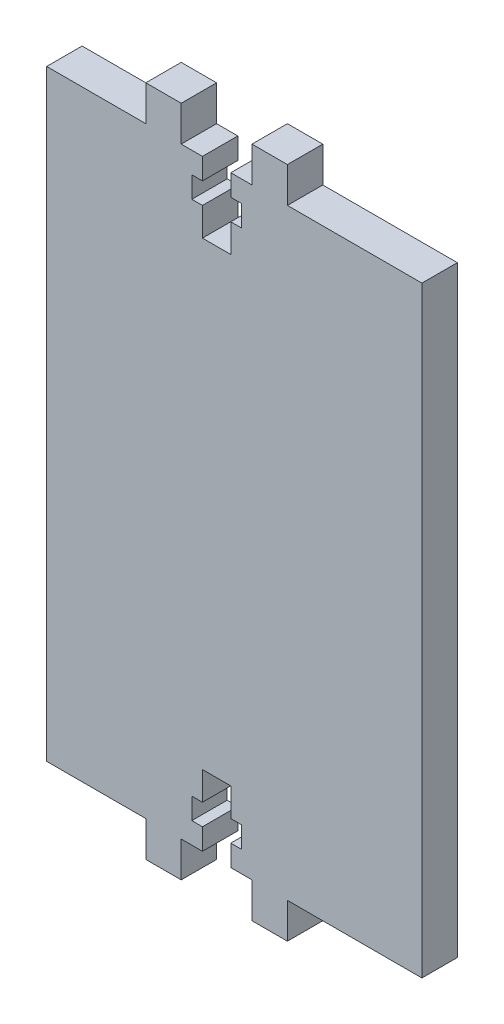
from build123d import *

# Parameters (mm, degrees)
BOSS_EXTRU_1_DEPTH = 5


with BuildPart() as part:
    # Esquisse2 → Boss.-Extru.1 (new body)
    with BuildSketch(Plane.XY):
        Polygon((-2, 82), (-3.5, 82), (-3.5, 79), (-2, 79), (-2, 75), (2, 75), (2, 79), (3.5, 79), (3.5, 82), (2, 82), (2, 85), (5, 85), (5, 90), (10, 90), (10, 85), (29, 85), (29, 0), (10, 0), (10, -5), (5, -5), (5, 0), (2, 0), (2, 3), (3.5, 3), (3.5, 6), (2, 6), (2, 10), (-2, 10), (-2, 6), (-3.5, 6), (-3.5, 3), (-2, 3), (-2, 0), (-5, 0), (-5, -5), (-10, -5), (-10, 0), (-24, 0), (-24, 85), (-10, 85), (-10, 90), (-5, 90), (-5, 85), (-2, 85), align=None)
    extrude(amount=BOSS_EXTRU_1_DEPTH)


solid = part.part
